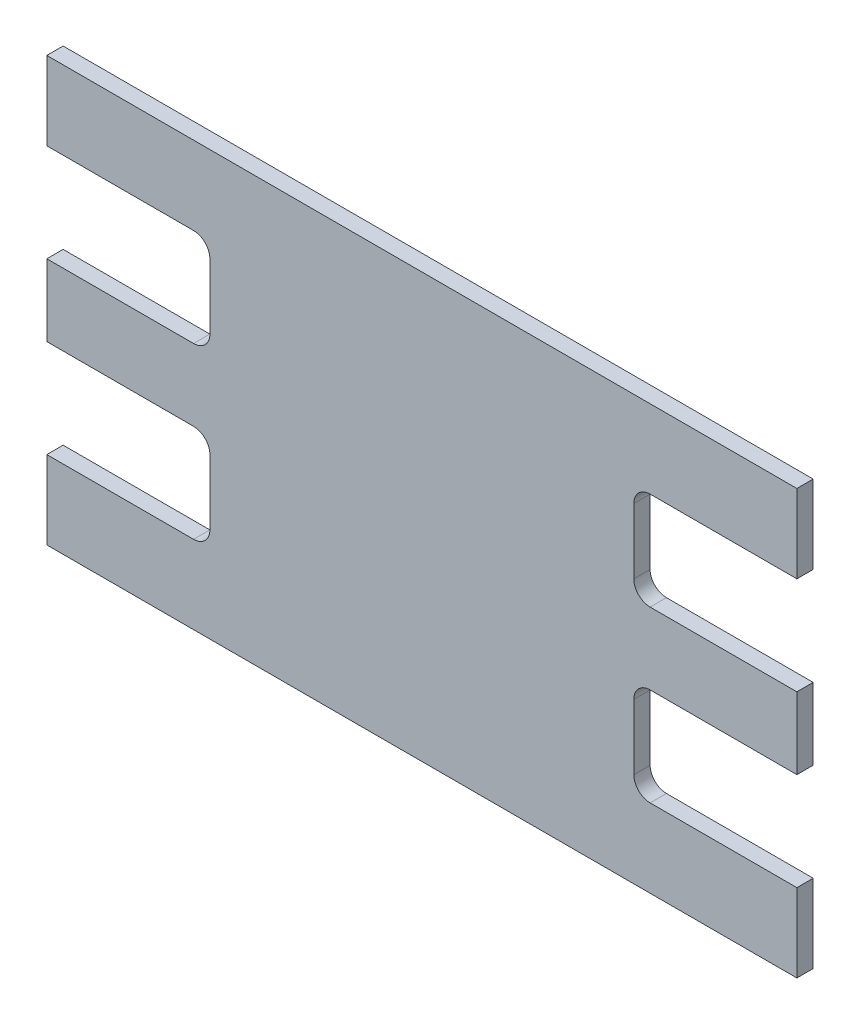
from build123d import *

# Parameters (mm, degrees)
SKETCH1_W           = 292.1
SKETCH1_H           = 165.1
BOSS_EXTRUDE1_DEPTH = 6.35
CUT_EXTRUDE1_DEPTH  = 168.885161643


with BuildPart() as part:
    # Sketch1 → Boss-Extrude1 (new body)
    with BuildSketch(Plane.XY):
        Rectangle(SKETCH1_W, SKETCH1_H)
    extrude(amount=BOSS_EXTRUDE1_DEPTH)

    # Sketch2 → Cut-Extrude1 (cut, through all)
    with BuildSketch(Plane.XY.offset(6.35)):
        with BuildLine():
            Line((-146.05, 52.07), (-88.9, 52.07))
            ThreePointArc((-88.9, 52.07), (-84.409871939, 50.210128061), (-82.55, 45.72))
            Line((-82.55, 45.72), (-82.55, 20.32))
            ThreePointArc((-82.55, 20.32), (-84.409871939, 15.829871939), (-88.9, 13.97))
            Line((-88.9, 13.97), (-146.05, 13.97))
            Line((-146.05, 13.97), (-146.05, 52.07))
        make_face()
        with BuildLine():
            Line((-146.05, -13.97), (-146.05, -52.07))
            Line((-146.05, -52.07), (-88.9, -52.07))
            ThreePointArc((-88.9, -52.07), (-84.409871939, -50.210128061), (-82.55, -45.72))
            Line((-82.55, -45.72), (-82.55, -20.32))
            ThreePointArc((-82.55, -20.32), (-84.409871939, -15.829871939), (-88.9, -13.97))
            Line((-88.9, -13.97), (-146.05, -13.97))
        make_face()
        with BuildLine():
            Line((146.05, -52.07), (88.9, -52.07))
            ThreePointArc((88.9, -52.07), (84.409871939, -50.210128061), (82.55, -45.72))
            Line((82.55, -45.72), (82.55, -20.32))
            ThreePointArc((82.55, -20.32), (84.409871939, -15.829871939), (88.9, -13.97))
            Line((88.9, -13.97), (146.05, -13.97))
            Line((146.05, -13.97), (146.05, -52.07))
        make_face()
        with BuildLine():
            Line((146.05, 13.97), (146.05, 52.07))
            Line((146.05, 52.07), (88.9, 52.07))
            ThreePointArc((88.9, 52.07), (84.409871939, 50.210128061), (82.55, 45.72))
            Line((82.55, 45.72), (82.55, 20.32))
            ThreePointArc((82.55, 20.32), (84.409871939, 15.829871939), (88.9, 13.97))
            Line((88.9, 13.97), (146.05, 13.97))
        make_face()
    extrude(amount=-CUT_EXTRUDE1_DEPTH, mode=Mode.SUBTRACT)


solid = part.part
